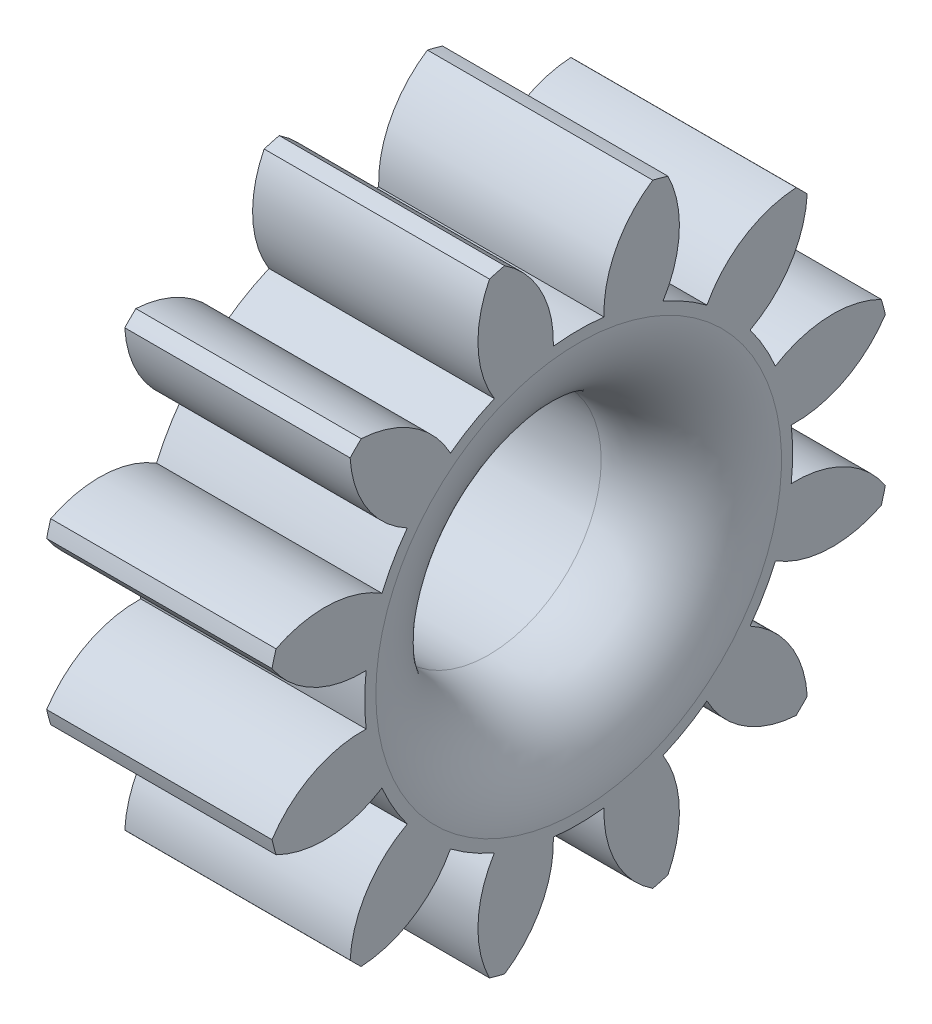
from build123d import *

# Parameters (mm, degrees)
BASPROSKE_W     = 5
BASPROSKE_H     = 7
TOOTHCUT_DEPTH  = 12.090536506
TEETHCUTS_COUNT = 12
TEETHCUTS_ANGLE = 330
BORSKE_R        = 2.5
BORE_DEPTH      = 50.0000508
REDONDEO1_R     = 2


with BuildPart() as part:
    # BasProSke → Base-Revolve (revolve)
    with BuildSketch(Plane(origin=(0, 0, 0), x_dir=(1, 0, 0), z_dir=(0, 1, 0)), mode=Mode.PRIVATE) as base_revolve_sk:
        with Locations((2.5, 3.5)):
            Rectangle(BASPROSKE_W, BASPROSKE_H)
    revolve(base_revolve_sk.sketch.rotate(Axis((-10, 0, 0), (1, 0, 0)), 180), axis=Axis((-10, 0, 0), (1, 0, 0)))

    # TooCutSke → ToothCut (cut, through all)
    with BuildSketch(Plane(origin=(0, 0, 0), x_dir=(0, 0, -1), z_dir=(1, 0, 0))):
        with BuildLine():
            ThreePointArc((0.562207301, 4.715604304), (0, 4.749), (-0.562207301, 4.715604304))
            ThreePointArc((-0.562207301, 4.715604304), (-0.837528627, 5.917009812), (-1.672850686, 6.823328788))
            ThreePointArc((-1.672850686, 6.823328788), (0, 7.0254), (1.672850686, 6.823328788))
            ThreePointArc((1.672850686, 6.823328788), (0.837528627, 5.917009812), (0.562207301, 4.715604304))
        make_face()
    toothcut = extrude(amount=TOOTHCUT_DEPTH, mode=Mode.SUBTRACT)

    # TeethCuts: ToothCut ×12 about axis
    teethcuts_axis = Axis((-10, 0, 0), (1, 0, 0))
    for i in range(1, TEETHCUTS_COUNT):
        add(toothcut.rotate(teethcuts_axis, i * TEETHCUTS_ANGLE / (TEETHCUTS_COUNT - 1)), mode=Mode.SUBTRACT)

    # BorSke → Bore (cut, symmetric)
    with BuildSketch(Plane(origin=(0, 0, 0), x_dir=(0, 0, -1), z_dir=(1, 0, 0))):
        with Locations(Location((0, 0, 0), (0, 0, 180))):
            Circle(BORSKE_R)
    extrude(amount=BORE_DEPTH, both=True, mode=Mode.SUBTRACT)

    # Redondeo1
    redondeo1_edges = [part.edges().sort_by_distance(p)[0] for p in [
        (5, 0, -2.5),
    ]]
    fillet(redondeo1_edges, radius=REDONDEO1_R)


solid = part.part
